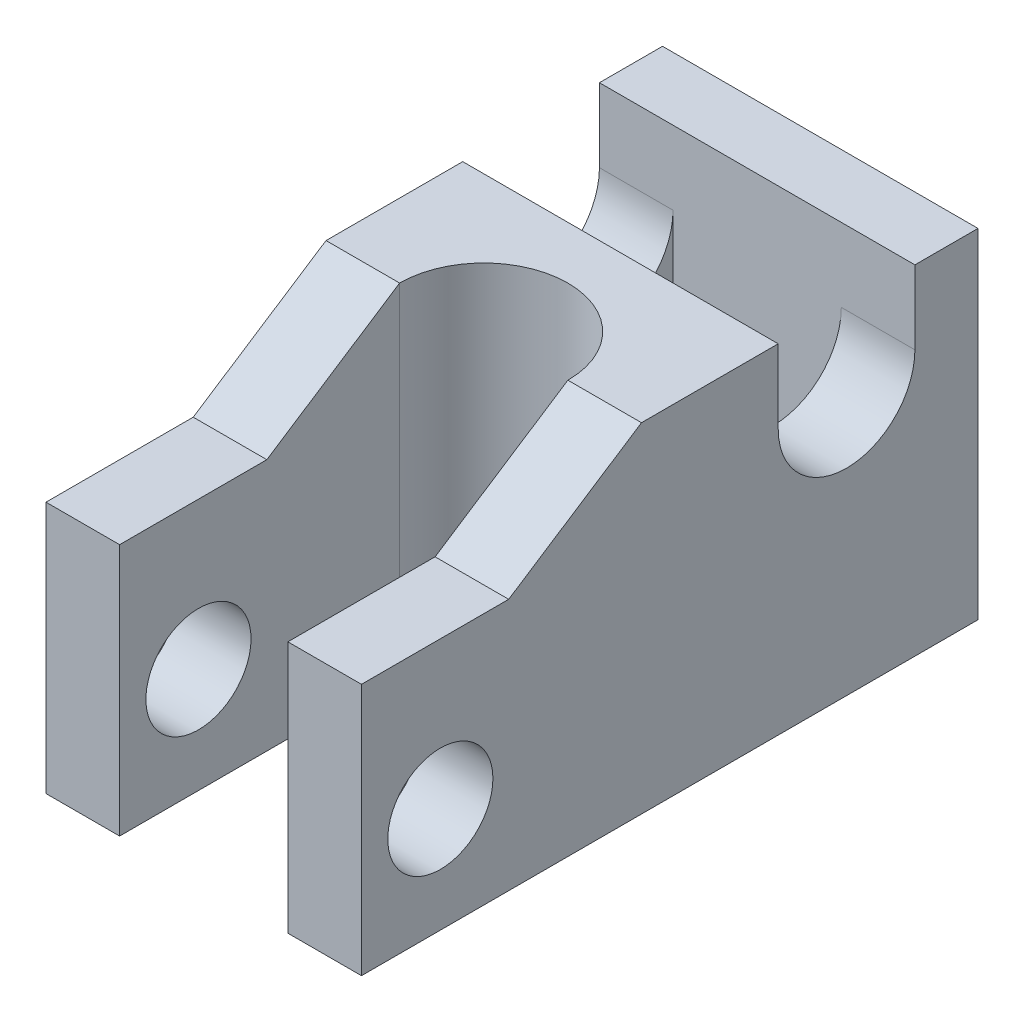
from build123d import *

# Parameters (mm, degrees)
SKETCH1_R           = 10
BOSS_EXTRUDE1_DEPTH = 14
BOSS_EXTRUDE2_DEPTH = 64
SKETCH4_W           = 60
SKETCH4_H           = 12
BOSS_EXTRUDE4_DEPTH = 64


with BuildPart() as part:
    # Sketch1 → Boss-Extrude1 (new body)
    with BuildSketch(Plane(origin=(0, 0, 0), x_dir=(0, 0, -1), z_dir=(1, 0, 0))):
        with BuildLine():
            ThreePointArc((17.877672838, 50.460908485), (30.877672838, 37.460908485), (43.877672838, 50.460908485))
            Line((43.877672838, 50.460908485), (43.877672838, 64.460908485))
            Line((43.877672838, 64.460908485), (55.877672838, 64.460908485))
            Line((55.877672838, 64.460908485), (55.877672838, 0))
            Line((55.877672838, 0), (-61.381998564, 0))
            Line((-61.381998564, 0), (-61.381998564, 48))
            Line((-61.381998564, 48), (-33.381998564, 48))
            Line((-33.381998564, 48), (-8.122327162, 64.460908485))
            Line((-8.122327162, 64.460908485), (17.877672838, 64.460908485))
            Line((17.877672838, 64.460908485), (17.877672838, 50.460908485))
        make_face()
        with Locations((-46.381998564, 20)):
            Circle(SKETCH1_R, mode=Mode.SUBTRACT)
    extrude(amount=-BOSS_EXTRUDE1_DEPTH)


with BuildPart() as body_2:
    # Mirror4: mirrored copy
    add(part.part.mirror(Plane.ZY.offset(30)))


with BuildPart() as part_1:
    add(part.part)

    add(body_2.part)  # Boss-Extrude2 merges body 2
    # Sketch2 → Boss-Extrude2 (add)
    with BuildSketch(Plane(origin=(0, 64.460908485, 0), x_dir=(1, 0, 0), z_dir=(0, 1, 0))):
        with BuildLine():
            Line((-14, 17.877672838), (-46, 17.877672838))
            Line((-46, 17.877672838), (-60, 17.877672838))
            Line((-60, 17.877672838), (-60, -8.122327162))
            Line((-60, -8.122327162), (-46, -8.122327162))
            ThreePointArc((-46, -8.122327162), (-30, 7.877672838), (-14, -8.122327162))
            Line((-14, -8.122327162), (0, -8.122327162))
            Line((0, -8.122327162), (0, 17.877672838))
            Line((0, 17.877672838), (-14, 17.877672838))
        make_face()
    extrude(amount=-BOSS_EXTRUDE2_DEPTH)

    # Sketch4 → Boss-Extrude4 (add)
    with BuildSketch(Plane(origin=(0, 64.460908485, 0), x_dir=(1, 0, 0), z_dir=(0, 1, 0))):
        with Locations((-30, 49.877672838)):
            Rectangle(SKETCH4_W, SKETCH4_H)
    extrude(amount=-BOSS_EXTRUDE4_DEPTH)


solid = part_1.part
